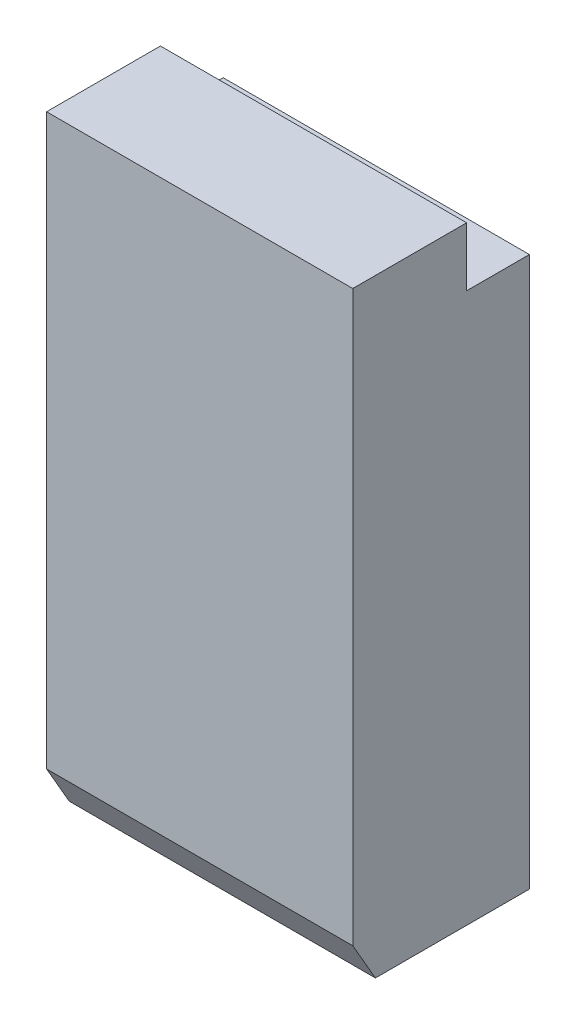
from build123d import *

# Parameters (mm, degrees)
EXTRUDE_1_DEPTH = 3.9
CHAMFER_1_SIZE  = 1
CHAMFER_1_SIZE2 = 0.577350269


with BuildPart() as part:
    # Эскиз1 → Бобышка-Вытянуть1 (new, symmetric)
    with BuildSketch(Plane(origin=(0, 0, 0), x_dir=(0, 0, -1), z_dir=(1, 0, 0))):
        Polygon((0, 0), (0, 1.5), (2.9, 1.5), (2.9, 0), (4.5, 0), (4.5, -14), (0, -14), align=None)
    extrude(amount=EXTRUDE_1_DEPTH, both=True)

    # Фаска1
    chamfer_1_edges = [part.edges().sort_by_distance(p)[0] for p in [
        (0, -14, 0),
    ]]
    chamfer_1_side = [part.faces().sort_by_distance(p)[0] for p in [
        (0, -6.25, 0),
    ]]
    chamfer(chamfer_1_edges, length=CHAMFER_1_SIZE, length2=CHAMFER_1_SIZE2, reference=chamfer_1_side[0])


solid = part.part
